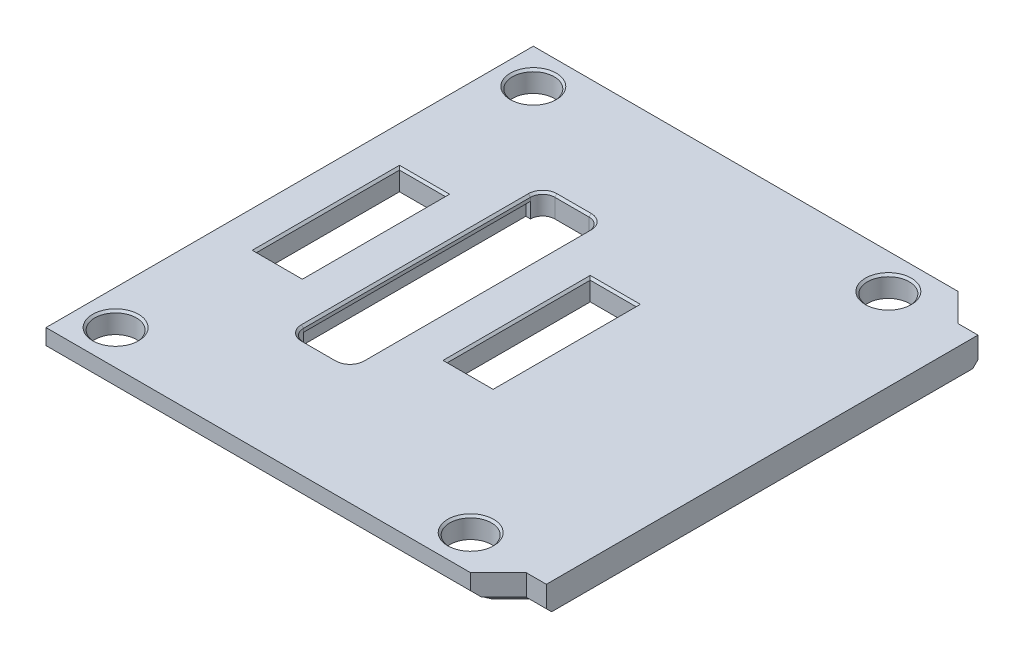
from build123d import *

# Parameters (mm, degrees)
SKETCH21_R          = 3
SKETCH21_W          = 6.6
SKETCH21_H          = 20.55
BOSS_EXTRUDE3_DEPTH = 3
BOSS_EXTRUDE2_DEPTH = 0.8
CUT_EXTRUDE1_DEPTH  = 2.2
CUT_EXTRUDE2_DEPTH  = 1
CHAMFER1_SIZE       = 0.3
CHAMFER2_SIZE       = 0.75


with BuildPart() as part:
    # Sketch21 → Boss-Extrude3 (new body)
    with BuildSketch(Plane(origin=(0, 0, 0), x_dir=(1, 0, 0), z_dir=(0, 1, 0))):
        Polygon((38.5, 35), (-22.5, 35), (-22.5, -35), (38.5, -35), (42.5, -31), (45.375, -31), (45.375, 31), (42.5, 31), align=None)
        with Locations(Location((-17.5, 30, 0), (0, 0, 270))):
            Circle(SKETCH21_R, mode=Mode.SUBTRACT)
        with Locations(Location((-17.5, -30, 0), (0, 0, 270))):
            Circle(SKETCH21_R, mode=Mode.SUBTRACT)
        with Locations(Location((33.5, -30, 0), (0, 0, 270))):
            Circle(SKETCH21_R, mode=Mode.SUBTRACT)
        with Locations(Location((33.5, 30, 0), (0, 0, 270))):
            Circle(SKETCH21_R, mode=Mode.SUBTRACT)
        with Locations((-13.7, 0)):
            Rectangle(SKETCH21_W, SKETCH21_H, mode=Mode.SUBTRACT)
        with BuildLine():
            Line((-4.21, 16.3), (-4.21, -16.3))
            ThreePointArc((-4.21, -16.3), (-3.697436867, -17.537436867), (-2.46, -18.05))
            Line((-2.46, -18.05), (2.46, -18.05))
            ThreePointArc((2.46, -18.05), (3.697436867, -17.537436867), (4.21, -16.3))
            Line((4.21, -16.3), (4.21, 16.3))
            ThreePointArc((4.21, 16.3), (3.697436867, 17.537436867), (2.46, 18.05))
            Line((2.46, 18.05), (-2.46, 18.05))
            ThreePointArc((-2.46, 18.05), (-3.697436867, 17.537436867), (-4.21, 16.3))
        make_face(mode=Mode.SUBTRACT)
        with Locations((13.7, 0)):
            Rectangle(SKETCH21_W, SKETCH21_H, mode=Mode.SUBTRACT)
    extrude(amount=BOSS_EXTRUDE3_DEPTH)

    # Sketch28 → Boss-Extrude2 (add)
    with BuildSketch(Plane.XZ):
        Polygon((39.5, 34), (39.5, -34), (42.5, -31), (45.375, -31), (45.375, 31), (42.5, 31), align=None)
    extrude(amount=BOSS_EXTRUDE2_DEPTH)

    # Sketch29 → Cut-Extrude1 (cut)
    with BuildSketch(Plane.XZ):
        Polygon((-4.21, 16.3), (-4.875, 16.3), (-4.875, -16.3), (-4.21, -16.3), (4.21, -16.3), (4.875, -16.3), (4.875, 16.3), (4.21, 16.3), align=None)
    extrude(amount=-CUT_EXTRUDE1_DEPTH, mode=Mode.SUBTRACT)

    # Sketch30 → Cut-Extrude2 (cut)
    # profile 1 of 4: a face of its own
    with BuildSketch(Plane.XZ):
        Polygon((30, -5.584415584), (30, -6.623376623), (23.194805195, -6.623376623), (30, -8.858766234), (30, -9.790584416), (23.194805195, -12.025974026), (30, -12.025974026), (30, -13.064935065), (22, -13.064935065), (22, -11.439935065), (28.668831169, -9.329545455), (22, -7.209415584), (22, -5.584415584), align=None)
    # profile 2 of 4: a face of its own
    with BuildSketch(Plane.XZ):
        with BuildLine():
            add(Edge.make_bspline(
                [(30.103896104, -1.798701299), (30.103067309, -1.895623244), (30.101458149, -2.083803562), (30.077120757, -2.356806977), (30.043441513, -2.612684332), (29.990720477, -2.849454628), (29.92681865, -3.069556735), (29.84494459, -3.270560491), (29.751676383, -3.4562646), (29.640184851, -3.621871579), (29.516615752, -3.772075178), (29.375879847, -3.901668661), (29.221972567, -4.015692158), (29.052257996, -4.109156913), (28.868514081, -4.186592109), (28.670085387, -4.243928609), (28.457107647, -4.285605452), (28.309709631, -4.297462408), (28.233766234, -4.303571429)],
                knots=[0, 0, 0, 0, 1.318794478, 2.560526035, 3.728243692, 4.829167506, 5.859211314, 6.844017696, 7.77958115, 8.682536498, 9.55583357, 10.420985288, 11.279874663, 12.156984126, 13.05163966, 13.988564904, 14.963654886, 16, 16, 16, 16], degree=3))
            Line((28.233766234, -4.303571429), (28.233766234, -3.26461039))
            add(Edge.make_bspline(
                [(28.233766234, -3.26461039), (28.276082816, -3.263564761), (28.357947694, -3.261541907), (28.476134337, -3.240166384), (28.586751637, -3.212672627), (28.688349357, -3.17036585), (28.783864525, -3.121500377), (28.868666466, -3.055998852), (28.946860594, -2.982137003), (29.015350514, -2.895594265), (29.078413582, -2.799861025), (29.128391442, -2.689971645), (29.17548457, -2.57144951), (29.209220227, -2.440779669), (29.240159157, -2.300318747), (29.257500765, -2.147495072), (29.271994968, -1.984042329), (29.272478757, -1.871250975), (29.272727273, -1.813311688)],
                knots=[0, 0, 0, 0, 1.000573209, 1.935690443, 2.836843993, 3.693268586, 4.535782358, 5.368499125, 6.220215677, 7.076544447, 7.975601122, 8.926814499, 9.928453325, 10.991382637, 12.117004715, 13.331014315, 14.628980654, 16, 16, 16, 16], degree=3))
            add(Edge.make_bspline(
                [(29.272727273, -1.813311688), (29.272477286, -1.761323175), (29.271992064, -1.660413873), (29.25754424, -1.51369465), (29.239472891, -1.376258483), (29.21132631, -1.248275466), (29.176555316, -1.130075024), (29.131923796, -1.021611339), (29.080501402, -0.922166793), (29.001941506, -0.806296479), (28.891278773, -0.682718379), (28.73659228, -0.572587187), (28.562614518, -0.50468464), (28.440535545, -0.497283039), (28.378246753, -0.493506494)],
                knots=[0, 0, 0, 0, 1.049722362, 2.037502948, 2.975957546, 3.848689641, 4.682196446, 5.461765277, 6.214820971, 6.939488855, 8.285974658, 9.541612251, 10.745648019, 12, 12, 12, 12], degree=3))
            add(Edge.make_bspline(
                [(28.378246753, -0.493506494), (28.346763417, -0.494183282), (28.285509435, -0.495500043), (28.198094752, -0.513038493), (28.116989153, -0.536078954), (28.043895516, -0.573277175), (27.978132386, -0.620152847), (27.91781187, -0.675968403), (27.867975971, -0.743948686), (27.822461309, -0.822779364), (27.783044583, -0.918968765), (27.736245211, -1.032239323), (27.690729471, -1.168941517), (27.640192756, -1.326342557), (27.586743359, -1.505529733), (27.52981461, -1.706135721), (27.472099938, -1.929578583), (27.410484723, -2.167825675), (27.348547139, -2.408916775), (27.281606559, -2.638344652), (27.213843382, -2.85068402), (27.144538665, -3.046605107), (27.071027512, -3.224150567), (26.999273376, -3.386230737), (26.921988655, -3.529162978), (26.844897165, -3.658210405), (26.757806858, -3.771639817), (26.655650322, -3.868805026), (26.538272332, -3.949974022), (26.405573224, -4.015399248), (26.259022178, -4.067101625), (26.096859779, -4.104654298), (25.919870357, -4.124614358), (25.797123614, -4.128080852), (25.733766234, -4.12987013)],
                knots=[0, 0, 0, 0, 0.609469888, 1.185784659, 1.72354831, 2.239788445, 2.766795736, 3.28643782, 3.825837257, 4.394650866, 5.047817349, 5.838989728, 6.771546224, 7.840191231, 9.04536596, 10.397473415, 11.883969141, 13.520573579, 15.169980156, 16.710930355, 18.154580726, 19.492276644, 20.739482987, 21.88068629, 22.927624582, 23.888735019, 24.79347993, 25.691627909, 26.611521855, 27.550140283, 28.552530272, 29.619112255, 30.771072804, 32, 32, 32, 32], degree=3))
            add(Edge.make_bspline(
                [(25.733766234, -4.12987013), (25.67520802, -4.127970482), (25.560134212, -4.12423745), (25.391367911, -4.095537471), (25.230466456, -4.050698077), (25.077097455, -3.986528081), (24.932327589, -3.902583067), (24.793763605, -3.802331737), (24.665049855, -3.681655436), (24.543482, -3.546039193), (24.43312437, -3.394260688), (24.339684079, -3.227132066), (24.257615927, -3.049505201), (24.190985373, -2.859321562), (24.141623211, -2.656271887), (24.103560771, -2.442230454), (24.083220864, -2.215216877), (24.079718791, -2.060100694), (24.077922078, -1.980519481)],
                knots=[0, 0, 0, 0, 0.925490325, 1.81869781, 2.698985002, 3.561843198, 4.439506826, 5.339694674, 6.260029024, 7.223537863, 8.216200057, 9.220155366, 10.24621711, 11.306974059, 12.400590692, 13.547020494, 14.741516967, 16, 16, 16, 16], degree=3))
            add(Edge.make_bspline(
                [(24.077922078, -1.980519481), (24.079100785, -1.889033894), (24.081391296, -1.711255453), (24.100967879, -1.45323672), (24.133116756, -1.211952726), (24.17768197, -0.988210503), (24.236413566, -0.781944584), (24.307185153, -0.593035368), (24.392098481, -0.421208329), (24.489260392, -0.266089492), (24.600165531, -0.128414151), (24.72493983, -0.008947344), (24.86185203, 0.094298865), (25.012592849, 0.179129373), (25.17622274, 0.24610088), (25.353001809, 0.293934263), (25.542097394, 0.327525812), (25.673013023, 0.334222491), (25.74025974, 0.337662338)],
                knots=[0, 0, 0, 0, 1.35942475, 2.641688414, 3.842675212, 4.97503988, 6.028837698, 7.026524857, 7.968775207, 8.872346758, 9.741443809, 10.588878301, 11.433254833, 12.283089724, 13.152223979, 14.05361, 15.000208458, 16, 16, 16, 16], degree=3))
            Line((25.74025974, 0.337662338), (25.74025974, -0.701298701))
            add(Edge.make_bspline(
                [(25.74025974, -0.701298701), (25.674721832, -0.708715551), (25.549076856, -0.722934647), (25.375375364, -0.789794963), (25.22801032, -0.891278982), (25.108112126, -1.029254824), (25.017480494, -1.20236831), (24.95378105, -1.408593969), (24.915339674, -1.647931329), (24.911256881, -1.818566714), (24.909090909, -1.909090909)],
                knots=[0, 0, 0, 0, 0.958885329, 1.838312007, 2.683388096, 3.544636038, 4.476874501, 5.512704297, 6.680458674, 8, 8, 8, 8], degree=3))
            add(Edge.make_bspline(
                [(24.909090909, -1.909090909), (24.910895743, -1.990953805), (24.914357274, -2.147960509), (24.950990134, -2.372453696), (25.008423519, -2.575331214), (25.076523787, -2.727354018), (25.141975259, -2.834516311), (25.197828471, -2.902415345), (25.256998255, -2.962751797), (25.325503304, -3.006899846), (25.395422474, -3.046527148), (25.472769579, -3.071306954), (25.554938786, -3.088887883), (25.61190975, -3.090222262), (25.641233766, -3.090909091)],
                knots=[0, 0, 0, 0, 1.898886608, 3.641917703, 5.263913708, 6.781775949, 7.492829293, 8.171637923, 8.820129793, 9.443813489, 10.056392137, 10.680075833, 11.320610447, 12, 12, 12, 12], degree=3))
            add(Edge.make_bspline(
                [(25.641233766, -3.090909091), (25.693601745, -3.088173991), (25.793343993, -3.082964606), (25.932521067, -3.032755637), (26.046460672, -2.946847813), (26.120477608, -2.847186421), (26.16971367, -2.744863761), (26.211505197, -2.642238609), (26.256566207, -2.515362815), (26.304827388, -2.364194696), (26.357408524, -2.188599575), (26.409102043, -1.987553747), (26.469062821, -1.762972788), (26.527292162, -1.519674479), (26.590317686, -1.2725332), (26.656464534, -1.035158817), (26.725715485, -0.814577671), (26.79891335, -0.611735187), (26.873636009, -0.425204125), (26.951004783, -0.255596696), (27.03015641, -0.102152272), (27.113523202, 0.035276924), (27.205414194, 0.157824135), (27.315001132, 0.261070929), (27.438169167, 0.349818461), (27.576625602, 0.423191195), (27.731509238, 0.478381448), (27.901145757, 0.516112898), (28.08529053, 0.541358551), (28.213113542, 0.544058296), (28.279220779, 0.545454545)],
                knots=[0, 0, 0, 0, 0.886876726, 1.689182582, 2.470212093, 3.276978007, 3.770089089, 4.396329915, 5.157818963, 6.055717916, 7.090729244, 8.269771542, 9.580232216, 11.037716353, 12.51750611, 13.910932755, 15.221554488, 16.442288017, 17.571848501, 18.632682187, 19.606715272, 20.501836021, 21.360120455, 22.198499933, 23.047686038, 23.931415603, 24.849906235, 25.830634081, 26.878051879, 28, 28, 28, 28], degree=3))
            add(Edge.make_bspline(
                [(28.279220779, 0.545454545), (28.34371882, 0.543630808), (28.470156379, 0.540055678), (28.655638898, 0.510463378), (28.832279264, 0.459141376), (29.001301578, 0.390285703), (29.160557988, 0.298734214), (29.312612514, 0.189780286), (29.455421384, 0.059180933), (29.587891688, -0.090437305), (29.709455888, -0.255056432), (29.815732766, -0.434994432), (29.904732119, -0.628858396), (29.978152624, -0.836386007), (30.034513409, -1.057599571), (30.074835203, -1.292625486), (30.099493407, -1.541138559), (30.10240589, -1.711522119), (30.103896104, -1.798701299)],
                knots=[0, 0, 0, 0, 0.930697296, 1.824475469, 2.702134557, 3.581182897, 4.452177757, 5.347490549, 6.276448989, 7.239081344, 8.228006388, 9.226020669, 10.250015029, 11.302452558, 12.399371731, 13.540990107, 14.741812496, 16, 16, 16, 16], degree=3))
        make_face()
    # profile 3 of 4: a face of its own
    with BuildSketch(Plane.XZ):
        Polygon((28.12987013, 6.675324675), (28.12987013, 5.636363636), (30, 5.636363636), (30, 4.597402597), (28.12987013, 4.597402597), (28.12987013, 1.168831169), (27.298701299, 1.168831169), (21.896103896, 4.823051948), (21.896103896, 5.636363636), (27.298701299, 5.636363636), (27.298701299, 6.675324675), align=None)
        Polygon((27.298701299, 4.597402597), (23.647727273, 4.597402597), (27.298701299, 2.128246753), align=None, mode=Mode.SUBTRACT)
    # profile 4 of 4: a face of its own
    with BuildSketch(Plane.XZ):
        with BuildLine():
            add(Edge.make_bspline(
                [(24.878246753, 8.961038961), (24.814187466, 9.018718223), (24.688796852, 9.131620481), (24.52623408, 9.319626512), (24.38902696, 9.516006238), (24.274055052, 9.719122635), (24.185259096, 9.932124103), (24.124260188, 10.154220452), (24.085370567, 10.385004196), (24.080429628, 10.542051167), (24.077922078, 10.621753247)],
                knots=[0, 0, 0, 0, 1.085250411, 2.124285525, 3.122966424, 4.099740098, 5.059495047, 6.022248179, 6.996281616, 8, 8, 8, 8], degree=3))
            add(Edge.make_bspline(
                [(24.077922078, 10.621753247), (24.080388406, 10.71442069), (24.085197844, 10.895125927), (24.123411532, 11.157861469), (24.184306732, 11.404870872), (24.272255, 11.635752436), (24.387153957, 11.849110858), (24.524114245, 12.048005833), (24.688142408, 12.229328525), (24.877058745, 12.392596956), (25.086654972, 12.538797969), (25.315305287, 12.664833525), (25.559504609, 12.774982728), (25.822560693, 12.861856011), (26.102716801, 12.930025074), (26.400708473, 12.978028939), (26.715845271, 13.007721006), (26.931750621, 13.011204737), (27.042207792, 13.012987013)],
                knots=[0, 0, 0, 0, 1.032558834, 2.013531219, 2.952724632, 3.863440268, 4.759334089, 5.647806176, 6.548963813, 7.476698465, 8.425450168, 9.392113565, 10.383030705, 11.407311388, 12.475256329, 13.593801989, 14.76898917, 16, 16, 16, 16], degree=3))
            add(Edge.make_bspline(
                [(27.042207792, 13.012987013), (27.157541132, 13.010763865), (27.382188592, 13.006433594), (27.709535495, 12.974051549), (28.017782216, 12.918849126), (28.307815796, 12.842667109), (28.580203904, 12.746008442), (28.833597649, 12.625035021), (29.068200596, 12.482093506), (29.282094588, 12.31769338), (29.474911402, 12.138602071), (29.643383348, 11.946244921), (29.785901829, 11.742265117), (29.901915152, 11.525799081), (29.993700364, 11.298532687), (30.0563313, 11.058394628), (30.096796644, 10.808192264), (30.101508048, 10.637064002), (30.103896104, 10.550324675)],
                knots=[0, 0, 0, 0, 1.255961248, 2.446374192, 3.578096896, 4.663065679, 5.708848904, 6.721082169, 7.715645011, 8.695165174, 9.654207175, 10.577283402, 11.474815653, 12.358130333, 13.246756847, 14.137354944, 15.05588606, 16, 16, 16, 16], degree=3))
            add(Edge.make_bspline(
                [(30.103896104, 10.550324675), (30.101957507, 10.473402044), (30.098135909, 10.321762811), (30.06994442, 10.09904847), (30.024642656, 9.885538268), (29.961678515, 9.681233999), (29.877748249, 9.487089156), (29.776994728, 9.301656094), (29.658183542, 9.124227831), (29.565007665, 9.015871412), (29.517857143, 8.961038961)],
                knots=[0, 0, 0, 0, 1.064402764, 2.098279994, 3.101513528, 4.082158303, 5.051759688, 6.023614418, 6.999874063, 8, 8, 8, 8], degree=3))
            Line((29.517857143, 8.961038961), (32.285714286, 8.961038961))
            Line((32.285714286, 8.961038961), (32.285714286, 7.922077922))
            Line((32.285714286, 7.922077922), (24.181818182, 7.922077922))
            Line((24.181818182, 7.922077922), (24.181818182, 8.961038961))
            Line((24.181818182, 8.961038961), (24.878246753, 8.961038961))
        make_face()
        with BuildLine():
            add(Edge.make_bspline(
                [(28.582792208, 8.961038961), (28.638068094, 9.016806457), (28.746272219, 9.125972921), (28.88604868, 9.30468271), (29.005525826, 9.488624463), (29.10353432, 9.678758798), (29.178838914, 9.875397967), (29.232421931, 10.077816102), (29.266023104, 10.286763726), (29.270477616, 10.428446258), (29.272727273, 10.5)],
                knots=[0, 0, 0, 0, 1.085707992, 2.125304366, 3.132607823, 4.117140125, 5.079411284, 6.040195589, 7.010242569, 8, 8, 8, 8], degree=3))
            add(Edge.make_bspline(
                [(29.272727273, 10.5), (29.271564887, 10.555333141), (29.269292802, 10.663491349), (29.239839848, 10.820741082), (29.196497459, 10.96900301), (29.136257851, 11.109490038), (29.055236931, 11.23925618), (28.959450301, 11.36231131), (28.844022134, 11.474748696), (28.712202831, 11.578371652), (28.563994598, 11.673419787), (28.397122683, 11.754505361), (28.212848364, 11.821562178), (28.013017105, 11.879403423), (27.794752168, 11.919663171), (27.5604292, 11.953303498), (27.308137994, 11.969921857), (27.134757703, 11.972630718), (27.045454545, 11.974025974)],
                knots=[0, 0, 0, 0, 0.883090077, 1.726152498, 2.546968976, 3.348612605, 4.159853212, 4.985030933, 5.834983544, 6.727674538, 7.660828743, 8.643132597, 9.685597177, 10.791445765, 11.963314957, 13.229053737, 14.572765964, 16, 16, 16, 16], degree=3))
            add(Edge.make_bspline(
                [(27.045454545, 11.974025974), (26.960488256, 11.972475312), (26.795809545, 11.969469872), (26.556459939, 11.955037872), (26.334057605, 11.922691005), (26.126274149, 11.883838663), (25.935303572, 11.829227501), (25.757782142, 11.767878791), (25.598800519, 11.688161553), (25.452904693, 11.601577669), (25.325039242, 11.502172732), (25.21216834, 11.39471845), (25.119935221, 11.274953005), (25.042443311, 11.14727479), (24.981985433, 11.010401495), (24.939903278, 10.863480785), (24.913104526, 10.707694614), (24.91044575, 10.600220469), (24.909090909, 10.545454545)],
                knots=[0, 0, 0, 0, 1.408584611, 2.730069766, 3.970578609, 5.131496849, 6.230442265, 7.260312358, 8.239039861, 9.17271741, 10.067908288, 10.917833178, 11.748516327, 12.565283383, 13.388525032, 14.22012764, 15.093025089, 16, 16, 16, 16], degree=3))
            add(Edge.make_bspline(
                [(24.909090909, 10.545454545), (24.911597622, 10.473740048), (24.91662789, 10.329829249), (24.967176055, 10.118412528), (25.041627812, 9.910177473), (25.150533213, 9.709114776), (25.288800898, 9.511868337), (25.4585467, 9.321890573), (25.656752375, 9.134221833), (25.805680198, 9.020282822), (25.883116883, 8.961038961)],
                knots=[0, 0, 0, 0, 0.889314606, 1.784603949, 2.686204335, 3.630395475, 4.614970347, 5.672211878, 6.789640565, 8, 8, 8, 8], degree=3))
            Line((25.883116883, 8.961038961), (28.582792208, 8.961038961))
        make_face(mode=Mode.SUBTRACT)
    extrude(amount=-CUT_EXTRUDE2_DEPTH, mode=Mode.SUBTRACT)

    # Chamfer1
    chamfer1_edges = [part.edges().sort_by_distance(p)[0] for p in [
        (-17.5, 3, -33),
        (-17.5, 3, 27),
        (33.5, 3, 27),
        (33.5, 3, -33),
        (-13.7, 3, 10.275),
        (-10.4, 3, 0),
        (-13.7, 3, -10.275),
        (-17, 3, 0),
        (-3.697436867, 3, -17.537436867),
        (-4.21, 3, 0),
        (-3.697436867, 3, 17.537436867),
        (0, 3, 18.05),
        (3.697436867, 3, 17.537436867),
        (4.21, 3, 0),
        (3.697436867, 3, -17.537436867),
        (0, 3, -18.05),
        (17, 3, 0),
        (13.7, 3, -10.275),
        (10.4, 3, 0),
        (13.7, 3, 10.275),
    ]]
    chamfer(chamfer1_edges, length=CHAMFER1_SIZE)

    # Chamfer2
    chamfer2_edges = [part.edges().sort_by_distance(p)[0] for p in [
        (8, 0, 35),
        (-22.5, 0, 0),
        (41, -0.8, -32.5),
        (43.9375, -0.8, -31),
        (43.9375, -0.8, 31),
        (41, -0.8, 32.5),
        (8, 0, -35),
    ]]
    chamfer(chamfer2_edges, length=CHAMFER2_SIZE)


solid = part.part
